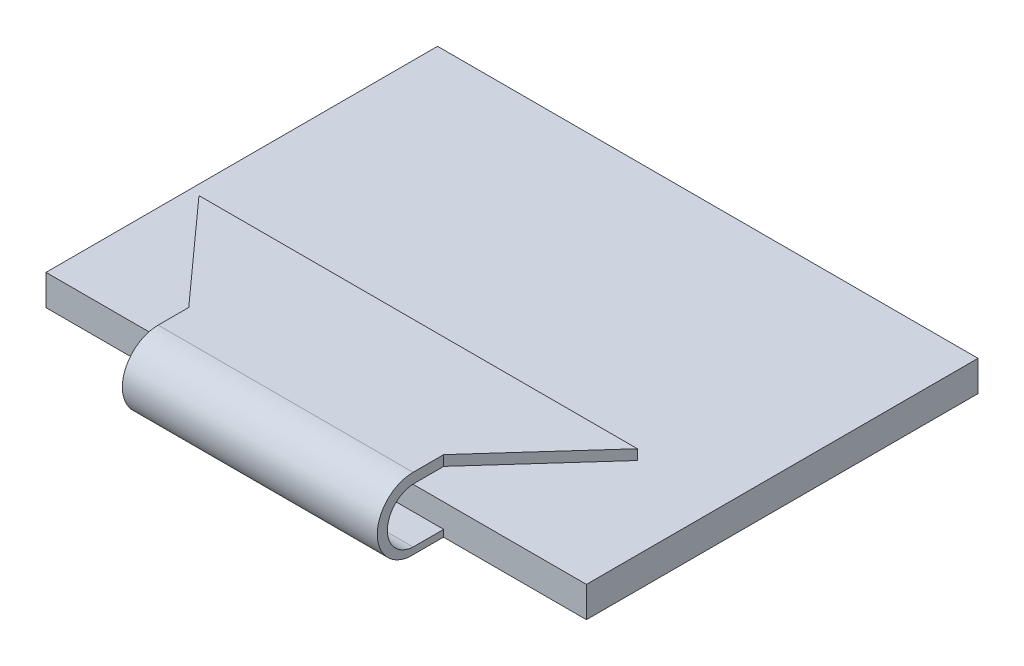
from build123d import *

# Parameters (mm, degrees)
SKETCH1_W           = 26.5
SKETCH1_H           = 19.2
BOSS_EXTRUDE1_DEPTH = 1.5
SKETCH2_W           = 12.5
SKETCH2_H           = 3.5
BOSS_EXTRUDE2_DEPTH = 3.5
CUT_EXTRUDE1_DEPTH  = 18
SKETCH4_W           = 12.5
SKETCH4_H           = 0.5
BOSS_EXTRUDE3_DEPTH = 5
BOSS_EXTRUDE4_DEPTH = 0.5


with BuildPart() as part:
    # Sketch1 → Boss-Extrude1 (new body)
    with BuildSketch(Plane(origin=(0, 0, 0), x_dir=(1, 0, 0), z_dir=(0, 1, 0))):
        with Locations((3.967391304, -3.07826087)):
            Rectangle(SKETCH1_W, SKETCH1_H)
    extrude(amount=BOSS_EXTRUDE1_DEPTH)

    # Sketch2 → Boss-Extrude2 (add)
    with BuildSketch(Plane.XY.offset(12.67826087)):
        with Locations((3.967391304, 1.76)):
            Rectangle(SKETCH2_W, SKETCH2_H)
    extrude(amount=BOSS_EXTRUDE2_DEPTH)

    # Sketch3 → Cut-Extrude1 (cut)
    with BuildSketch(Plane.ZY.offset(2.282608696)):
        with BuildLine():
            Line((14.17826087, 3.01), (12.67826087, 3.01))
            Line((12.67826087, 3.01), (12.67826087, 1.5))
            Line((12.67826087, 1.5), (12.67826087, 0.336807219))
            Line((12.67826087, 0.336807219), (14.17826087, 0.336807219))
            ThreePointArc((14.17826087, 0.336807219), (15.439541787, 1.67340361), (14.17826087, 3.01))
        make_face()
        with BuildLine():
            Line((16.17826087, 3.51), (14.17826087, 3.51))
            ThreePointArc((14.17826087, 3.51), (15.93151881, 1.860671544), (14.392294136, 0.01))
            Line((14.392294136, 0.01), (16.17826087, 0.01))
            Line((16.17826087, 0.01), (16.17826087, 3.51))
        make_face()
    extrude(amount=-CUT_EXTRUDE1_DEPTH, mode=Mode.SUBTRACT)

    # Sketch4 → Boss-Extrude3 (add)
    with BuildSketch(Plane(origin=(0, 0, 12.67826087), x_dir=(-1, 0, 0), z_dir=(0, 0, -1))):
        with Locations((-3.967391304, 3.26)):
            Rectangle(SKETCH4_W, SKETCH4_H)
    extrude(amount=BOSS_EXTRUDE3_DEPTH)

    # Sketch6 → Boss-Extrude4 (add)
    with BuildSketch(Plane(origin=(0, 3.51, 0), x_dir=(1, 0, 0), z_dir=(0, 1, 0))):
        Polygon((-2.282608696, -7.67826087), (-6.782608696, -7.67826087), (-2.282608696, -12.67826087), align=None)
        Polygon((10.217391304, -7.67826087), (14.717391304, -7.67826087), (10.217391304, -12.67826087), align=None)
    extrude(amount=-BOSS_EXTRUDE4_DEPTH)


solid = part.part
